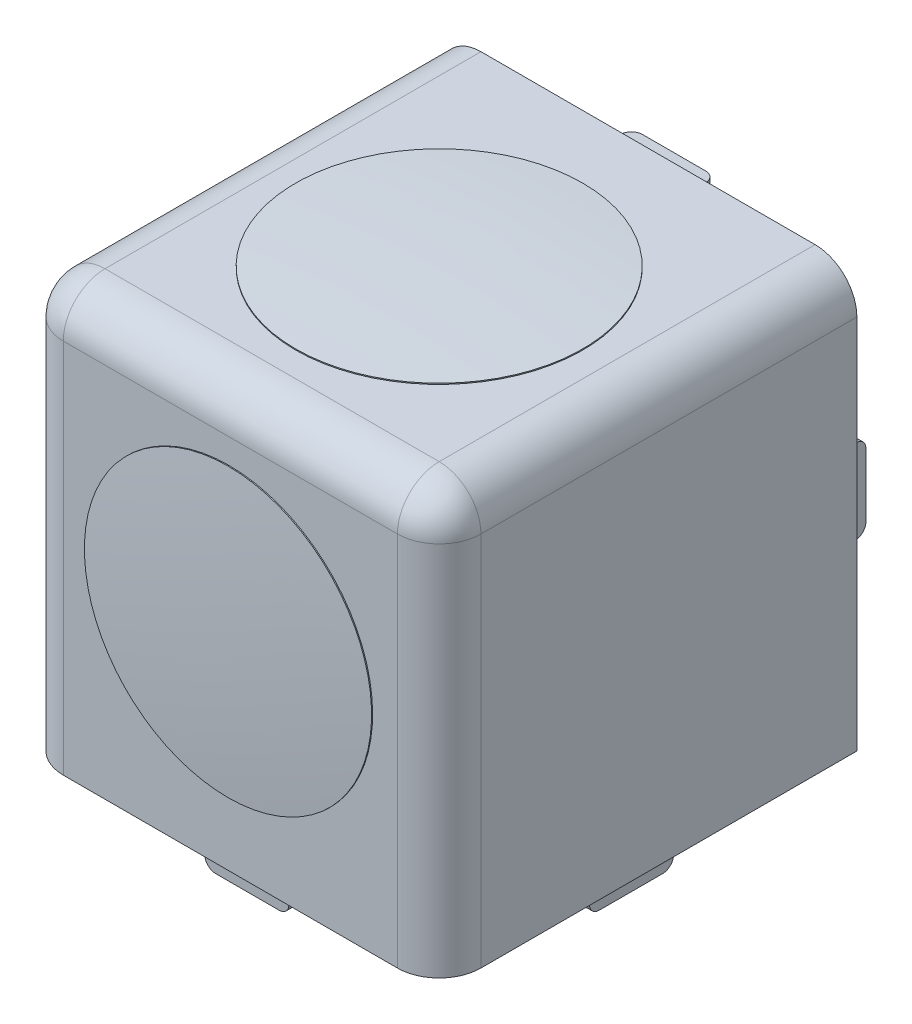
from build123d import *

# Parameters (mm, degrees)
SKETCH1_W                     = 40
SKETCH1_H                     = 40
BOSS_EXTRUDE1_DEPTH           = 40
SKETCH3_W                     = 8.2
SKETCH3_H                     = 2.2
BOSS_EXTRUDE2_DEPTH           = 2.5
BOSS_EXTRUDE2_DRAFT           = 3
SKETCH3_W_2                   = 2.2
SKETCH3_H_2                   = 8.2
BOSS_EXTRUDE2_PROFILE_2_DEPTH = 2.5
BOSS_EXTRUDE2_PROFILE_2_DRAFT = 3
BOSS_EXTRUDE2_PROFILE_3_DEPTH = 2.5
BOSS_EXTRUDE2_PROFILE_3_DRAFT = 3
FILLET1_R                     = 1
MIRROR1_COPY_1_SKETCH_W       = 8.2
MIRROR1_COPY_1_SKETCH_H       = 2.2
MIRROR1_COPY_1_DEPTH          = 2.5
MIRROR1_COPY_1_DRAFT          = 3
MIRROR1_COPY_2_SKETCH_W       = 2.2
MIRROR1_COPY_2_SKETCH_H       = 8.2
MIRROR1_COPY_2_DEPTH          = 2.5
MIRROR1_COPY_2_DRAFT          = 3
MIRROR1_COPY_3_SKETCH_W       = 2.2
MIRROR1_COPY_3_SKETCH_H       = 8.2
MIRROR1_COPY_3_DEPTH          = 2.5
MIRROR1_COPY_3_DRAFT          = 3
MIRROR1_COPY_4_SKETCH_W       = 2.2
MIRROR1_COPY_4_SKETCH_H       = 8.2
MIRROR1_COPY_4_DEPTH          = 2.5
MIRROR1_COPY_4_DRAFT          = 3
MIRROR1_COPY_5_SKETCH_W       = 2.2
MIRROR1_COPY_5_SKETCH_H       = 8.2
MIRROR1_COPY_5_DEPTH          = 2.5
MIRROR1_COPY_5_DRAFT          = 3
FILLET1_OF_MIRROR1_R          = 1
SKETCH5_W                     = 10.5
SKETCH5_H                     = 10.5
CUT_EXTRUDE2_DEPTH            = 10.5
FILLET3_R                     = 1
FILLET4_R                     = 4


with BuildPart() as part:
    # Sketch1 → Boss-Extrude1 (new body)
    with BuildSketch(Plane(origin=(0, 0, 0), x_dir=(1, 0, 0), z_dir=(0, 1, 0))):
        with Locations((0, -20)):
            Rectangle(SKETCH1_W, SKETCH1_H)
    extrude(amount=BOSS_EXTRUDE1_DEPTH)

    # Sketch2 → Cut-Revolve1 (revolve, cut)
    with BuildSketch(Plane(origin=(0, 0, 0), x_dir=(0, 0, -1), z_dir=(1, 0, 0)), mode=Mode.PRIVATE) as cut_revolve1_sk:
        with BuildLine():
            Line((-40, 20), (-40, 33))
            Line((-40, 33), (-39.255216938, 32.255216938))
            ThreePointArc((-39.255216938, 32.255216938), (-38.942854013, 32.043532509), (-38.574287105, 31.962666394))
            Line((-38.574287105, 31.962666394), (-19.723359022, 31.46903747))
            ThreePointArc((-19.723359022, 31.46903747), (-15.422245538, 30.509793506), (-11.8, 28))
            Line((-11.8, 28), (-7.4, 28))
            Line((-7.4, 28), (-3.5, 24.25))
            Line((-3.5, 24.25), (0, 24.25))
            Line((0, 24.25), (0, 20))
            Line((0, 20), (-40, 20))
        make_face()
    cut_revolve1 = revolve(cut_revolve1_sk.sketch.rotate(Axis((0, 20, 0), (0, 0, 1)), 90), axis=Axis((0, 20, 0), (0, 0, 1)), mode=Mode.SUBTRACT)


with BuildPart() as boss_extrude2_tool:
    # Sketch3 → Boss-Extrude2 (with draft: the straight prism first)
    with BuildSketch(Plane(origin=(0, 0, 0), x_dir=(-1, 0, 0), z_dir=(0, 0, -1))):
        with Locations((0, 37.4)):
            Rectangle(SKETCH3_W, SKETCH3_H)
    extrude(amount=BOSS_EXTRUDE2_DEPTH)
    # Boss-Extrude2: the draft: its side faces are tilted about the plane it starts from
    boss_extrude2_sides = [boss_extrude2_tool.faces().sort_by_distance(p)[0] for p in [
        (4.1, 37.4, -1.25),
        (0, 36.3, -1.25),
        (-4.1, 37.4, -1.25),
        (0, 38.5, -1.25),
    ]]
    draft(boss_extrude2_sides, Plane(origin=(0, 0, 0), x_dir=(-1, 0, 0), z_dir=(0, 0, -1)), BOSS_EXTRUDE2_DRAFT)


with BuildPart() as part_1:
    add(part.part)

    # Boss-Extrude2: add boss_extrude2_tool
    add(boss_extrude2_tool.part)


with BuildPart() as boss_extrude2_profile_2_tool:
    # Sketch3 → Boss-Extrude2 profile 2 (with draft: the straight prism first)
    with BuildSketch(Plane(origin=(0, 0, 0), x_dir=(-1, 0, 0), z_dir=(0, 0, -1))):
        with Locations((-17.4, 20)):
            Rectangle(SKETCH3_W_2, SKETCH3_H_2)
    extrude(amount=BOSS_EXTRUDE2_PROFILE_2_DEPTH)
    # Boss-Extrude2 profile 2: the draft: its side faces are tilted about the plane it starts from
    boss_extrude2_profile_2_sides = [boss_extrude2_profile_2_tool.faces().sort_by_distance(p)[0] for p in [
        (18.5, 20, -1.25),
        (17.4, 15.9, -1.25),
        (16.3, 20, -1.25),
        (17.4, 24.1, -1.25),
    ]]
    draft(boss_extrude2_profile_2_sides, Plane(origin=(0, 0, 0), x_dir=(-1, 0, 0), z_dir=(0, 0, -1)), BOSS_EXTRUDE2_PROFILE_2_DRAFT)


with BuildPart() as part_2:
    add(part_1.part)

    # Boss-Extrude2 profile 2: add boss_extrude2_profile_2_tool
    add(boss_extrude2_profile_2_tool.part)


with BuildPart() as boss_extrude2_profile_3_tool:
    # Sketch3 → Boss-Extrude2 profile 3 (with draft: the straight prism first)
    with BuildSketch(Plane(origin=(0, 0, 0), x_dir=(-1, 0, 0), z_dir=(0, 0, -1))):
        with Locations((17.4, 20)):
            Rectangle(SKETCH3_W_2, SKETCH3_H_2)
    extrude(amount=BOSS_EXTRUDE2_PROFILE_3_DEPTH)
    # Boss-Extrude2 profile 3: the draft: its side faces are tilted about the plane it starts from
    boss_extrude2_profile_3_sides = [boss_extrude2_profile_3_tool.faces().sort_by_distance(p)[0] for p in [
        (-16.3, 20, -1.25),
        (-17.4, 15.9, -1.25),
        (-18.5, 20, -1.25),
        (-17.4, 24.1, -1.25),
    ]]
    draft(boss_extrude2_profile_3_sides, Plane(origin=(0, 0, 0), x_dir=(-1, 0, 0), z_dir=(0, 0, -1)), BOSS_EXTRUDE2_PROFILE_3_DRAFT)


with BuildPart() as part_3:
    add(part_2.part)

    # Boss-Extrude2 profile 3: add boss_extrude2_profile_3_tool
    add(boss_extrude2_profile_3_tool.part)

    # Fillet1
    fillet1_edges = [part_3.edges().sort_by_distance(p)[0] for p in [
        (3.968980552, 37.4, -2.5),
        (-3.968980552, 37.4, -2.5),
        (17.4, 16.031019448, -2.5),
        (17.4, 23.968980552, -2.5),
        (-17.4, 16.031019448, -2.5),
        (-17.4, 23.968980552, -2.5),
    ]]
    fillet(fillet1_edges, radius=FILLET1_R)

    # Mirror1: Cut-Revolve1 across plane
    add(cut_revolve1.mirror(Plane(origin=(0, 0, 0), x_dir=(0, 0.7071067811865478, 0.7071067811865472), z_dir=(0, 0.7071067811865475, -0.7071067811865477))), mode=Mode.SUBTRACT)


with BuildPart() as mirror1_copy_1_tool:
    # Mirror1 copy 1 sketch → Mirror1 copy 1 (with draft: the straight prism first)
    with BuildSketch(Plane(origin=(0, 0, 0), x_dir=(-1, 0, 0), z_dir=(0, -1, 0))):
        with Locations((0, -37.4)):
            Rectangle(MIRROR1_COPY_1_SKETCH_W, MIRROR1_COPY_1_SKETCH_H)
    extrude(amount=MIRROR1_COPY_1_DEPTH)
    # Mirror1 copy 1: the draft: its side faces are tilted about the plane it starts from
    mirror1_copy_1_sides = [mirror1_copy_1_tool.faces().sort_by_distance(p)[0] for p in [
        (4.1, -1.25, 37.4),
        (0, -1.25, 36.3),
        (-4.1, -1.25, 37.4),
        (0, -1.25, 38.5),
    ]]
    draft(mirror1_copy_1_sides, Plane(origin=(0, 0, 0), x_dir=(-1, 0, 0), z_dir=(0, -1, 0)), MIRROR1_COPY_1_DRAFT)


with BuildPart() as part_4:
    add(part_3.part)

    # Mirror1 copy 1: add mirror1_copy_1_tool
    add(mirror1_copy_1_tool.part)


with BuildPart() as mirror1_copy_2_tool:
    # Mirror1 copy 2 sketch → Mirror1 copy 2 (with draft: the straight prism first)
    with BuildSketch(Plane(origin=(0, 0, 0), x_dir=(-1, 0, 0), z_dir=(0, -1, 0))):
        with Locations((-17.4, -20)):
            Rectangle(MIRROR1_COPY_2_SKETCH_W, MIRROR1_COPY_2_SKETCH_H)
    extrude(amount=MIRROR1_COPY_2_DEPTH)
    # Mirror1 copy 2: the draft: its side faces are tilted about the plane it starts from
    mirror1_copy_2_sides = [mirror1_copy_2_tool.faces().sort_by_distance(p)[0] for p in [
        (18.5, -1.25, 20),
        (17.4, -1.25, 15.9),
        (16.3, -1.25, 20),
        (17.4, -1.25, 24.1),
    ]]
    draft(mirror1_copy_2_sides, Plane(origin=(0, 0, 0), x_dir=(-1, 0, 0), z_dir=(0, -1, 0)), MIRROR1_COPY_2_DRAFT)


with BuildPart() as part_5:
    add(part_4.part)

    # Mirror1 copy 2: add mirror1_copy_2_tool
    add(mirror1_copy_2_tool.part)


with BuildPart() as mirror1_copy_3_tool:
    # Mirror1 copy 3 sketch → Mirror1 copy 3 (with draft: the straight prism first)
    with BuildSketch(Plane(origin=(0, 0, 0), x_dir=(-1, 0, 0), z_dir=(0, -1, 0))):
        with Locations((17.4, -20)):
            Rectangle(MIRROR1_COPY_3_SKETCH_W, MIRROR1_COPY_3_SKETCH_H)
    extrude(amount=MIRROR1_COPY_3_DEPTH)
    # Mirror1 copy 3: the draft: its side faces are tilted about the plane it starts from
    mirror1_copy_3_sides = [mirror1_copy_3_tool.faces().sort_by_distance(p)[0] for p in [
        (-16.3, -1.25, 20),
        (-17.4, -1.25, 15.9),
        (-18.5, -1.25, 20),
        (-17.4, -1.25, 24.1),
    ]]
    draft(mirror1_copy_3_sides, Plane(origin=(0, 0, 0), x_dir=(-1, 0, 0), z_dir=(0, -1, 0)), MIRROR1_COPY_3_DRAFT)


with BuildPart() as part_6:
    add(part_5.part)

    # Mirror1 copy 3: add mirror1_copy_3_tool
    add(mirror1_copy_3_tool.part)


with BuildPart() as mirror1_copy_4_tool:
    # Mirror1 copy 4 sketch → Mirror1 copy 4 (with draft: the straight prism first)
    with BuildSketch(Plane(origin=(0, 0, 0), x_dir=(-1, 0, 0), z_dir=(0, -1, 0))):
        with Locations((-17.4, -20)):
            Rectangle(MIRROR1_COPY_4_SKETCH_W, MIRROR1_COPY_4_SKETCH_H)
    extrude(amount=MIRROR1_COPY_4_DEPTH)
    # Mirror1 copy 4: the draft: its side faces are tilted about the plane it starts from
    mirror1_copy_4_sides = [mirror1_copy_4_tool.faces().sort_by_distance(p)[0] for p in [
        (18.5, -1.25, 20),
        (17.4, -1.25, 15.9),
        (16.3, -1.25, 20),
        (17.4, -1.25, 24.1),
    ]]
    draft(mirror1_copy_4_sides, Plane(origin=(0, 0, 0), x_dir=(-1, 0, 0), z_dir=(0, -1, 0)), MIRROR1_COPY_4_DRAFT)


with BuildPart() as part_7:
    add(part_6.part)

    # Mirror1 copy 4: add mirror1_copy_4_tool
    add(mirror1_copy_4_tool.part)


with BuildPart() as mirror1_copy_5_tool:
    # Mirror1 copy 5 sketch → Mirror1 copy 5 (with draft: the straight prism first)
    with BuildSketch(Plane(origin=(0, 0, 0), x_dir=(-1, 0, 0), z_dir=(0, -1, 0))):
        with Locations((17.4, -20)):
            Rectangle(MIRROR1_COPY_5_SKETCH_W, MIRROR1_COPY_5_SKETCH_H)
    extrude(amount=MIRROR1_COPY_5_DEPTH)
    # Mirror1 copy 5: the draft: its side faces are tilted about the plane it starts from
    mirror1_copy_5_sides = [mirror1_copy_5_tool.faces().sort_by_distance(p)[0] for p in [
        (-16.3, -1.25, 20),
        (-17.4, -1.25, 15.9),
        (-18.5, -1.25, 20),
        (-17.4, -1.25, 24.1),
    ]]
    draft(mirror1_copy_5_sides, Plane(origin=(0, 0, 0), x_dir=(-1, 0, 0), z_dir=(0, -1, 0)), MIRROR1_COPY_5_DRAFT)


with BuildPart() as part_8:
    add(part_7.part)

    # Mirror1 copy 5: add mirror1_copy_5_tool
    add(mirror1_copy_5_tool.part)

    # Fillet1 of Mirror1
    fillet1_of_mirror1_edges = [part_8.edges().sort_by_distance(p)[0] for p in [
        (3.968980552, -2.5, 37.4),
        (-3.968980552, -2.5, 37.4),
        (17.4, -2.5, 16.031019448),
        (17.4, -2.5, 23.968980552),
        (-17.4, -2.5, 16.031019448),
        (-17.4, -2.5, 23.968980552),
    ]]
    fillet(fillet1_of_mirror1_edges, radius=FILLET1_OF_MIRROR1_R)

    # Sketch5 → Cut-Extrude2 (cut)
    with BuildSketch(Plane(origin=(0, 0, 0), x_dir=(-1, 0, 0), z_dir=(0, 0, -1))):
        with Locations((0, 5.25)):
            Rectangle(SKETCH5_W, SKETCH5_H)
    extrude(amount=-CUT_EXTRUDE2_DEPTH, mode=Mode.SUBTRACT)

    # Fillet3
    fillet3_edges = [part_8.edges().sort_by_distance(p)[0] for p in [
        (-5.25, 5.25, 10.5),
        (-5.25, 10.5, 5.25),
        (5.25, 5.25, 10.5),
        (0, 10.5, 10.5),
        (5.25, 10.5, 5.25),
    ]]
    fillet(fillet3_edges, radius=FILLET3_R)

    # Fillet4
    fillet4_edges = [part_8.edges().sort_by_distance(p)[0] for p in [
        (20, 40, 20),
        (-20, 40, 20),
        (0, 40, 40),
        (20, 20, 40),
        (-20, 20, 40),
    ]]
    fillet(fillet4_edges, radius=FILLET4_R)


with BuildPart() as body_2:
    # Sketch6 → Revolve1 (revolve)
    with BuildSketch(Plane(origin=(0, 0, 0), x_dir=(0, 0, -1), z_dir=(1, 0, 0))):
        with BuildLine():
            Line((-40.725, 20), (-38.875, 20))
            Line((-38.875, 20), (-38.875, 30.725))
            Line((-38.875, 30.725), (-36.125, 30.725))
            Line((-36.125, 30.725), (-36.125, 31.975))
            Line((-36.125, 31.975), (-40.125, 31.975))
            Line((-40.125, 31.975), (-40.125, 33.75))
            Line((-40.125, 33.75), (-40.225, 33.75))
            ThreePointArc((-40.225, 33.75), (-40.599958705, 26.879543953), (-40.725, 20))
        make_face()
    revolve(axis=Axis((0, 20, 0), (0, 0, 1)))


with BuildPart() as body_3:
    # Mirror2: mirrored copy
    add(body_2.part.mirror(Plane(origin=(0, 0, 0), x_dir=(0, 0.7071067811865478, 0.7071067811865472), z_dir=(0, 0.7071067811865475, -0.7071067811865477))))


solid = Compound([part_8.part, body_2.part, body_3.part])
